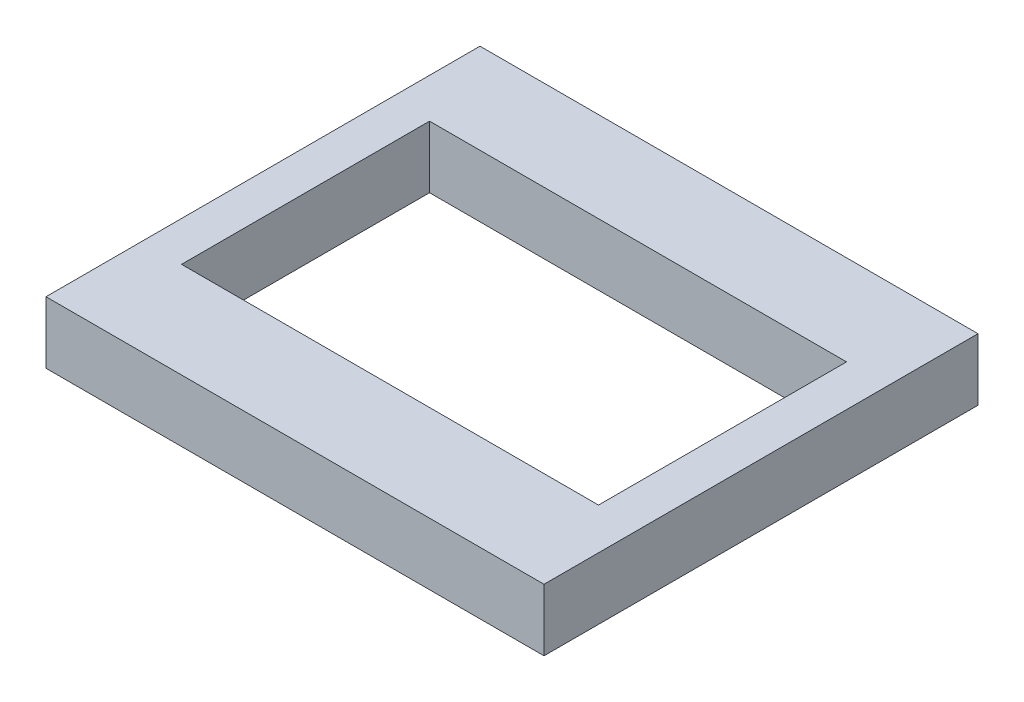
from build123d import *

# Parameters (mm, degrees)
SKETCH1_W           = 306.04968
SKETCH1_H           = 38.1
BOSS_EXTRUDE1_DEPTH = 266.7
SKETCH2_W           = 256.243215467
SKETCH2_H           = 152.4
CUT_EXTRUDE1_DEPTH  = 310.83399048


with BuildPart() as part:
    # Sketch1 → Boss-Extrude1 (new body)
    with BuildSketch(Plane.XY):
        Rectangle(SKETCH1_W, SKETCH1_H)
    extrude(amount=-BOSS_EXTRUDE1_DEPTH)

    # Sketch2 → Cut-Extrude1 (cut, through all)
    with BuildSketch(Plane.XZ.offset(19.05)):
        with Locations((-0.496767734, -135.091612863)):
            Rectangle(SKETCH2_W, SKETCH2_H)
    extrude(amount=-CUT_EXTRUDE1_DEPTH, mode=Mode.SUBTRACT)


solid = part.part
